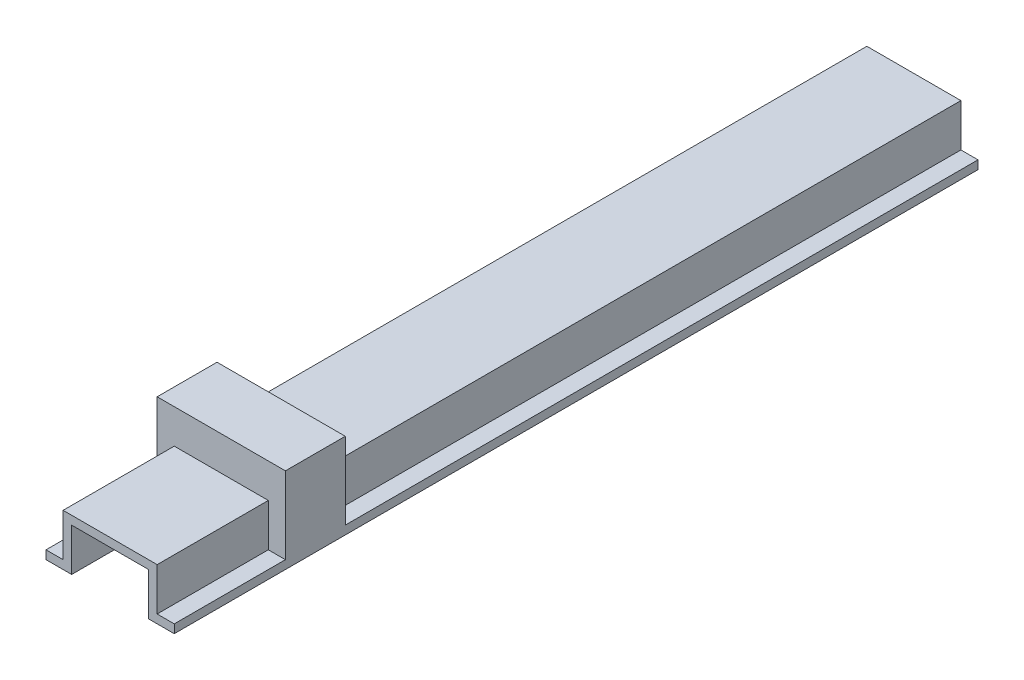
from build123d import *

# Parameters (mm, degrees)
BOSS_EXTRUDE1_DEPTH = 94
SKETCH2_W           = 15
SKETCH2_H           = 7
BOSS_EXTRUDE2_DEPTH = 9
SKETCH3_W           = 9
SKETCH3_H           = 7
CUT_EXTRUDE1_DEPTH  = 4
SKETCH4_W           = 5
SKETCH4_H           = 7
CUT_EXTRUDE2_DEPTH  = 12


with BuildPart() as part:
    # Sketch1 → Boss-Extrude1 (new body)
    with BuildSketch(Plane.XY):
        Polygon((-5.365984845, -2.186), (-7.365984845, -2.186), (-7.365984845, -3.186), (-4.365984845, -3.186), (-4.365984845, -2.186), (-4.365984845, 1.814), (4.634015155, 1.814), (4.634015155, -2.186), (4.634015155, -3.186), (7.634015155, -3.186), (7.634015155, -2.186), (5.634015155, -2.186), (5.634015155, 2.814), (-5.365984845, 2.814), align=None)
    extrude(amount=BOSS_EXTRUDE1_DEPTH)

    # Sketch2 → Boss-Extrude2 (add)
    with BuildSketch(Plane(origin=(0, -2.186, 0), x_dir=(1, 0, 0), z_dir=(0, 1, 0))):
        with Locations((0.134015155, -77.5)):
            Rectangle(SKETCH2_W, SKETCH2_H)
    extrude(amount=BOSS_EXTRUDE2_DEPTH)

    # Sketch3 → Cut-Extrude1 (cut)
    with BuildSketch(Plane.XZ.offset(2.186)):
        with Locations((0.134015155, 77.5)):
            Rectangle(SKETCH3_W, SKETCH3_H)
    extrude(amount=-CUT_EXTRUDE1_DEPTH, mode=Mode.SUBTRACT)

    # Sketch4 → Cut-Extrude2 (cut)
    with BuildSketch(Plane.ZY.offset(7.365984845)):
        with Locations((77.5, 2.314)):
            Rectangle(SKETCH4_W, SKETCH4_H)
    extrude(amount=-CUT_EXTRUDE2_DEPTH, mode=Mode.SUBTRACT)


solid = part.part
